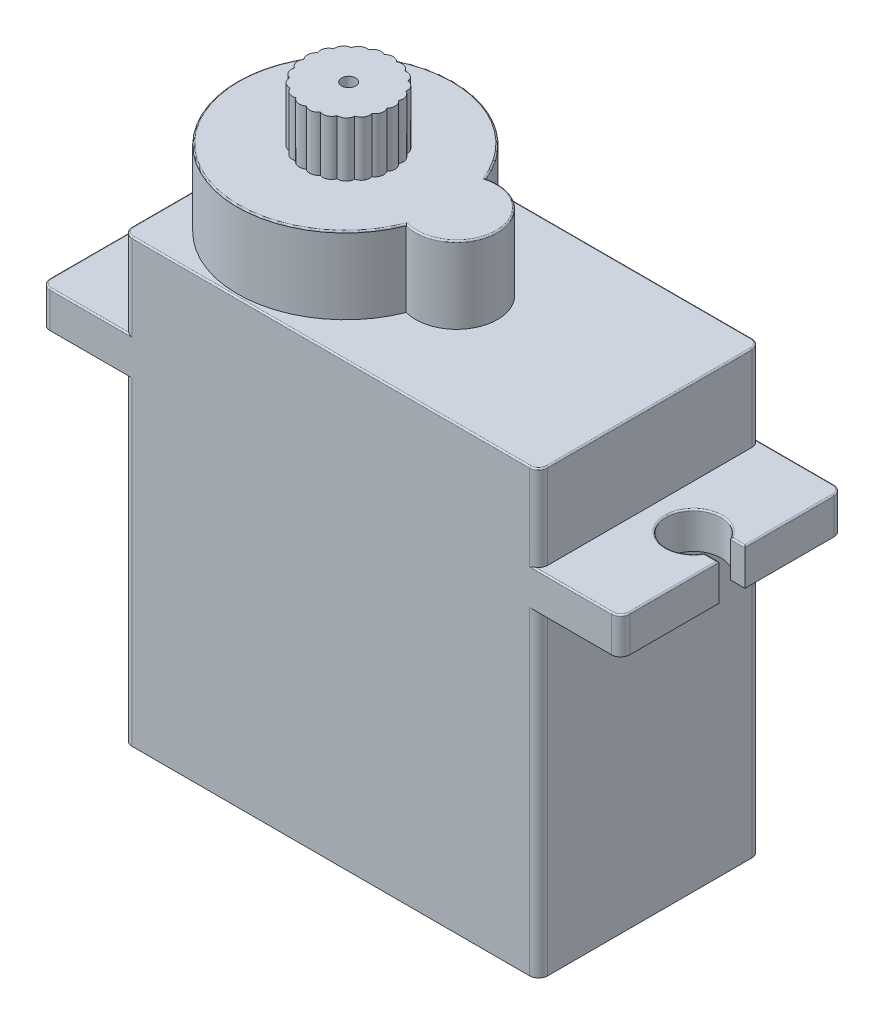
from build123d import *

# Parameters (mm, degrees)
SKETCH_1_W          = 22.8
SKETCH_1_H          = 24.2
EXTRUDE_1_DEPTH     = 6.1
EXTRUDE_3_DEPTH     = 4.2
SKETCH_5_W          = 4.5
SKETCH_5_H          = 2
EXTRUDE_4_DEPTH     = 12.2
CUT_EXTRUDE_1_DEPTH = 2
SKETCH_7_R          = 0.384474671
EXTRUDE_5_DEPTH     = 3
FILLET_1_R          = 0.5
FILLET_2_R          = 0.08


with BuildPart() as part:
    # 草图1 → 凸台-拉伸1 (new, symmetric)
    with BuildSketch(Plane.XY):
        Rectangle(SKETCH_1_W, SKETCH_1_H)
    extrude(amount=EXTRUDE_1_DEPTH, both=True)

    # 草图4 → 凸台-拉伸3 (add)
    with BuildSketch(Plane(origin=(0, 12.1, 0), x_dir=(1, 0, 0), z_dir=(0, 1, 0))):
        with BuildLine():
            ThreePointArc((0.209836066, 2.171222359), (-11.222203982, 0), (0.209836066, -2.171222359))
            ThreePointArc((0.209836066, -2.171222359), (3.05, 0), (0.209836066, 2.171222359))
        make_face()
    extrude(amount=EXTRUDE_3_DEPTH)

    # 草图5 → 凸台-拉伸4 (add)
    with BuildSketch(Plane.XY.offset(6.1)):
        with Locations((13.65, 6.4)):
            Rectangle(SKETCH_5_W, SKETCH_5_H)
        with Locations((-13.65, 6.4)):
            Rectangle(SKETCH_5_W, SKETCH_5_H)
    extrude(amount=-EXTRUDE_4_DEPTH)

    # 草图6 → 切除-拉伸1 (cut)
    with BuildSketch(Plane(origin=(0, 7.4, 0), x_dir=(1, 0, 0), z_dir=(0, 1, 0))):
        with BuildLine():
            Line((15.9, 0.715652694), (15.118272059, 0.715652694))
            ThreePointArc((15.118272059, 0.715652694), (12.3, 0), (15.118272059, -0.715652694))
            Line((15.118272059, -0.715652694), (15.9, -0.715652694))
            Line((15.9, -0.715652694), (15.9, 0.715652694))
        make_face()
        with BuildLine():
            Line((-15.9, 0.715652694), (-15.118272059, 0.715652694))
            ThreePointArc((-15.118272059, 0.715652694), (-12.3, 0), (-15.118272059, -0.715652694))
            Line((-15.118272059, -0.715652694), (-15.9, -0.715652694))
            Line((-15.9, -0.715652694), (-15.9, 0.715652694))
        make_face()
    extrude(amount=-CUT_EXTRUDE_1_DEPTH, mode=Mode.SUBTRACT)

    # 草图7 → 凸台-拉伸5 (add)
    with BuildSketch(Plane(origin=(0, 16.3, 0), x_dir=(1, 0, 0), z_dir=(0, 1, 0))):
        with BuildLine():
            ThreePointArc((-4.10494696, 2.066158577), (-3.738413317, 1.992171241), (-3.541129904, 1.674523178))
            ThreePointArc((-3.541129904, 1.674523178), (-3.212688472, 1.495785204), (-3.117798218, 1.134099046))
            ThreePointArc((-3.117798218, 1.134099046), (-2.85663246, 0.866492087), (-2.87256678, 0.492905236))
            ThreePointArc((-2.87256678, 0.492905236), (-2.70188242, 0.160207346), (-2.82722548, -0.192085366))
            ThreePointArc((-2.82722548, -0.192085366), (-2.762188572, -0.560312521), (-2.985803091, -0.860008341))
            ThreePointArc((-2.985803091, -0.860008341), (-3.03219245, -1.231046162), (-3.334209297, -1.4515158))
            ThreePointArc((-3.334209297, -1.4515158), (-3.487903024, -1.792395948), (-3.841486677, -1.914049711))
            ThreePointArc((-3.841486677, -1.914049711), (-4.088828411, -2.194483489), (-4.46256141, -2.206511906))
            ThreePointArc((-4.46256141, -2.206511906), (-4.781573751, -2.401581542), (-5.14224828, -2.302915834))
            ThreePointArc((-5.14224828, -2.302915834), (-5.504585583, -2.395288535), (-5.820154126, -2.194695584))
            ThreePointArc((-5.820154126, -2.194695584), (-6.193621131, -2.176163631), (-6.436044039, -1.891467001))
            ThreePointArc((-6.436044039, -1.891467001), (-6.787456564, -1.763677037), (-6.935193498, -1.420173274))
            ThreePointArc((-6.935193498, -1.420173274), (-7.233326997, -1.19448), (-7.273250881, -0.822690919))
            ThreePointArc((-7.273250881, -0.822690919), (-7.491614885, -0.519148172), (-7.420178308, -0.152108866))
            ThreePointArc((-7.420178308, -0.152108866), (-7.539370217, 0.202312249), (-7.362920632, 0.531988728))
            ThreePointArc((-7.362920632, 0.531988728), (-7.372349721, 0.905796338), (-7.106565448, 1.168816788))
            ThreePointArc((-7.106565448, 1.168816788), (-7.005393902, 1.528796448), (-6.673891039, 1.701790348))
            ThreePointArc((-6.673891039, 1.701790348), (-6.471108394, 2.015956285), (-6.103342426, 2.083552367))
            ThreePointArc((-6.103342426, 2.083552367), (-5.816966809, 2.323989559), (-5.445615356, 2.280181614))
            ThreePointArc((-5.445615356, 2.280181614), (-5.101092498, 2.425526162), (-4.759151767, 2.274206719))
            ThreePointArc((-4.759151767, 2.274206719), (-4.387094035, 2.311544121), (-4.10494696, 2.066158577))
        make_face()
        with Locations(Location((-5.122203982, 0, 0), (0, 0, 270))):
            Circle(SKETCH_7_R, mode=Mode.SUBTRACT)
    extrude(amount=EXTRUDE_5_DEPTH)

    # 圆角1
    fillet_1_edges = [part.edges().sort_by_distance(p)[0] for p in [
        (-11.4, 9.75, 6.1),
        (11.4, 9.75, -6.1),
        (11.4, 9.75, 6.1),
        (15.9, 6.4, -6.1),
        (15.9, 6.4, 6.1),
        (-11.4, -3.35, -6.1),
        (-11.4, -3.35, 6.1),
        (-15.9, 6.4, -6.1),
        (-15.9, 6.4, 6.1),
        (11.4, -3.35, 6.1),
        (-11.4, 9.75, -6.1),
        (11.4, -3.35, -6.1),
    ]]
    fillet(fillet_1_edges, radius=FILLET_1_R)

    # 圆角2
    fillet_2_edges = [part.edges().sort_by_distance(p)[0] for p in [
        (3.05, 16.3, 0),
        (-11.222203982, 16.3, 0),
        (-11.253553391, 12.1, 5.953553391),
        (15.50913603, 7.4, 0.715652694),
        (15.50913603, 7.4, -0.715652694),
        (12.3, 7.4, 0),
        (13.15, 7.4, 6.1),
        (15.753553391, 7.4, 5.953553391),
        (15.9, 7.4, 3.157826347),
        (15.9, 7.4, -3.157826347),
        (15.753553391, 7.4, -5.953553391),
        (13.15, 7.4, -6.1),
        (-15.50913603, 7.4, 0.715652694),
        (-12.3, 7.4, 0),
        (-15.9, 7.4, -3.157826347),
        (-15.753553391, 7.4, -5.953553391),
        (-13.15, 7.4, -6.1),
        (-15.9, 7.4, 3.157826347),
        (-15.753553391, 7.4, 5.953553391),
        (-13.15, 7.4, 6.1),
        (-11.4, 12.1, 0),
        (-11.253553391, 12.1, -5.953553391),
        (11.253553391, 12.1, 5.953553391),
        (11.253553391, 12.1, -5.953553391),
        (0, 12.1, -6.1),
        (11.4, 12.1, 0),
        (0, 12.1, 6.1),
    ]]
    fillet(fillet_2_edges, radius=FILLET_2_R)


solid = part.part
